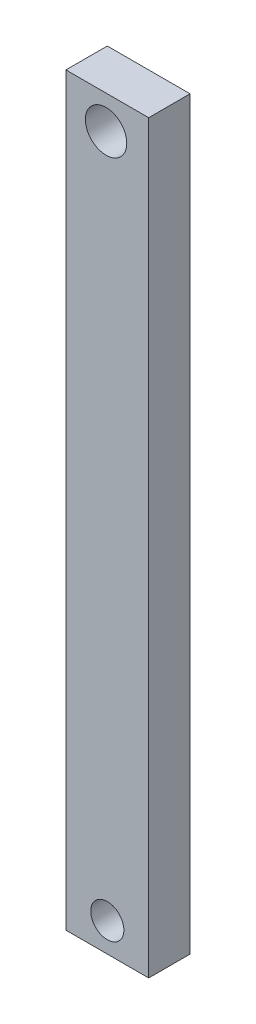
from build123d import *

# Parameters (mm, degrees)
SKETCH1_W           = 10
SKETCH1_H           = 90
BOSS_EXTRUDE1_DEPTH = 5
SKETCH2_R           = 2.5
SKETCH2_R_2         = 2
CUT_EXTRUDE1_DEPTH  = 84.155048284


with BuildPart() as part:
    # Sketch1 → Boss-Extrude1 (new body)
    with BuildSketch(Plane.XY):
        with Locations((-0.371900826, -37.830578512)):
            Rectangle(SKETCH1_W, SKETCH1_H)
    extrude(amount=BOSS_EXTRUDE1_DEPTH)

    # Sketch2 → Cut-Extrude1 (cut, through all)
    with BuildSketch(Plane.XY.offset(5)):
        with Locations((-0.521726903, 3.169421488)):
            Circle(SKETCH2_R)
        with Locations((-0.371900826, -79.330578512)):
            Circle(SKETCH2_R_2)
    extrude(amount=-CUT_EXTRUDE1_DEPTH, mode=Mode.SUBTRACT)


solid = part.part
